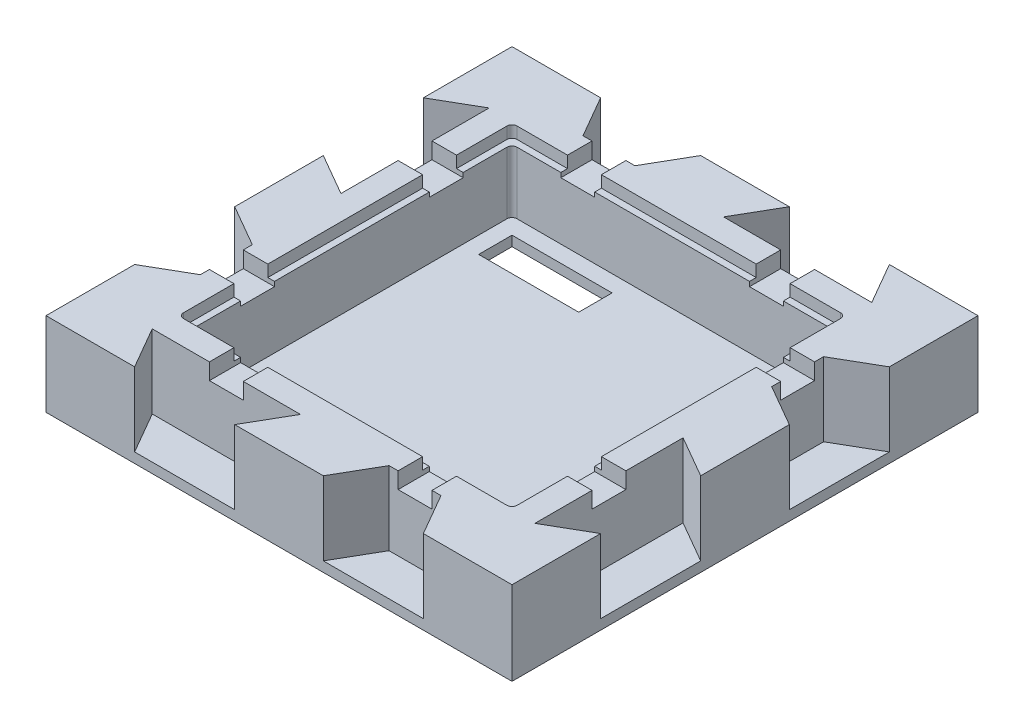
from build123d import *

# Parameters (mm, degrees)
SKETCH1_W           = 139.7
SKETCH1_H           = 139.7
BOSS_EXTRUDE1_DEPTH = 12.7
SKETCH2_W           = 139.7
SKETCH2_H           = 139.7
CUT_EXTRUDE1_DEPTH  = 0.3
CUT_EXTRUDE2_START  = -22.1
CUT_EXTRUDE2_DEPTH  = 125.021808265
SKETCH18_W          = 10.16
SKETCH18_H          = 4.875
CUT_EXTRUDE6_DEPTH  = 20
CIRPATTERN1_COUNT   = 4
SKETCH19_W          = 100
SKETCH19_H          = 100
CUT_EXTRUDE8_DEPTH  = 3.5
SKETCH20_W          = 96
SKETCH20_H          = 96
CUT_EXTRUDE9_DEPTH  = 18.6
SKETCH21_W          = 30
SKETCH21_H          = 10
CUT_EXTRUDE10_DEPTH = 102.224774635
FILLET2_R           = 1.5
CIRPATTERN2_COUNT   = 2


with BuildPart() as part:
    # Sketch1 → Boss-Extrude1 (new, symmetric)
    with BuildSketch(Plane(origin=(0, 0, 0), x_dir=(1, 0, 0), z_dir=(0, 1, 0))):
        Rectangle(SKETCH1_W, SKETCH1_H)
    extrude(amount=BOSS_EXTRUDE1_DEPTH, both=True)

    # Sketch2 → Cut-Extrude1 (cut)
    with BuildSketch(Plane(origin=(0, 12.7, 0), x_dir=(1, 0, 0), z_dir=(0, 1, 0))):
        Rectangle(SKETCH2_W, SKETCH2_H)
    extrude(amount=-CUT_EXTRUDE1_DEPTH, mode=Mode.SUBTRACT)

    # Sketch4 → Cut-Extrude2 (cut)
    with BuildSketch(Plane(origin=(0, 12.4, 0), x_dir=(1, 0, 0), z_dir=(0, 1, 0)).offset(CUT_EXTRUDE2_START)):
        Polygon((-43.283333333, -69.85), (-50.500211698, -57.35), (-6.066454968, -57.35), (-13.283333333, -69.85), align=None)
        Polygon((43.283333333, -69.85), (36.066454968, -57.35), (20.500211698, -57.35), (13.283333333, -69.85), align=None)
    cut_extrude2 = extrude(amount=CUT_EXTRUDE2_DEPTH, mode=Mode.SUBTRACT)

    # Sketch18 → Cut-Extrude6 (cut)
    with BuildSketch(Plane.XY.offset(57.35)):
        with Locations((28.283333333, 9.9625)):
            Rectangle(SKETCH18_W, SKETCH18_H)
        with Locations((-28.283333333, 9.9625)):
            Rectangle(SKETCH18_W, SKETCH18_H)
    cut_extrude6 = extrude(amount=-CUT_EXTRUDE6_DEPTH, mode=Mode.SUBTRACT)

    # CirPattern1: Cut-Extrude2, Cut-Extrude6 ×4 about axis
    cirpattern1_axis = Axis((0, 0, 0), (0, 1, 0))
    add([cut_extrude2.rotate(cirpattern1_axis, i * 360 / CIRPATTERN1_COUNT) for i in range(1, CIRPATTERN1_COUNT)], mode=Mode.SUBTRACT)
    add([cut_extrude6.rotate(cirpattern1_axis, i * 360 / CIRPATTERN1_COUNT) for i in range(1, CIRPATTERN1_COUNT)], mode=Mode.SUBTRACT)

    # Sketch19 → Cut-Extrude8 (cut)
    with BuildSketch(Plane(origin=(0, 12.4, 0), x_dir=(1, 0, 0), z_dir=(0, 1, 0))):
        Rectangle(SKETCH19_W, SKETCH19_H)
    extrude(amount=-CUT_EXTRUDE8_DEPTH, mode=Mode.SUBTRACT)

    # Sketch20 → Cut-Extrude9 (cut)
    with BuildSketch(Plane(origin=(0, 8.9, 0), x_dir=(1, 0, 0), z_dir=(0, 1, 0))):
        Rectangle(SKETCH20_W, SKETCH20_H)
    extrude(amount=-CUT_EXTRUDE9_DEPTH, mode=Mode.SUBTRACT)

    # Sketch21 → Cut-Extrude10 (cut, through all)
    with BuildSketch(Plane(origin=(0, -9.7, 0), x_dir=(1, 0, 0), z_dir=(0, 1, 0))):
        with Locations((-28, 38)):
            Rectangle(SKETCH21_W, SKETCH21_H)
    cut_extrude10 = extrude(amount=-CUT_EXTRUDE10_DEPTH, mode=Mode.SUBTRACT)

    # Fillet2
    fillet2_edges = [part.edges().sort_by_distance(p)[0] for p in [
        (50, 10.65, 50),
        (-50, 10.65, -50),
        (50, 10.65, -50),
        (-50, 10.65, 50),
        (48, -0.4, -48),
        (48, -0.4, 48),
        (-48, -0.4, 48),
        (-48, -0.4, -48),
    ]]
    fillet(fillet2_edges, radius=FILLET2_R)

    # CirPattern2: Cut-Extrude10 ×2 about axis
    cirpattern2_axis = Axis((0, 0, 0), (0, 1, 0))
    for i in range(1, CIRPATTERN2_COUNT):
        add(cut_extrude10.rotate(cirpattern2_axis, i * 360 / CIRPATTERN2_COUNT), mode=Mode.SUBTRACT)


solid = part.part
